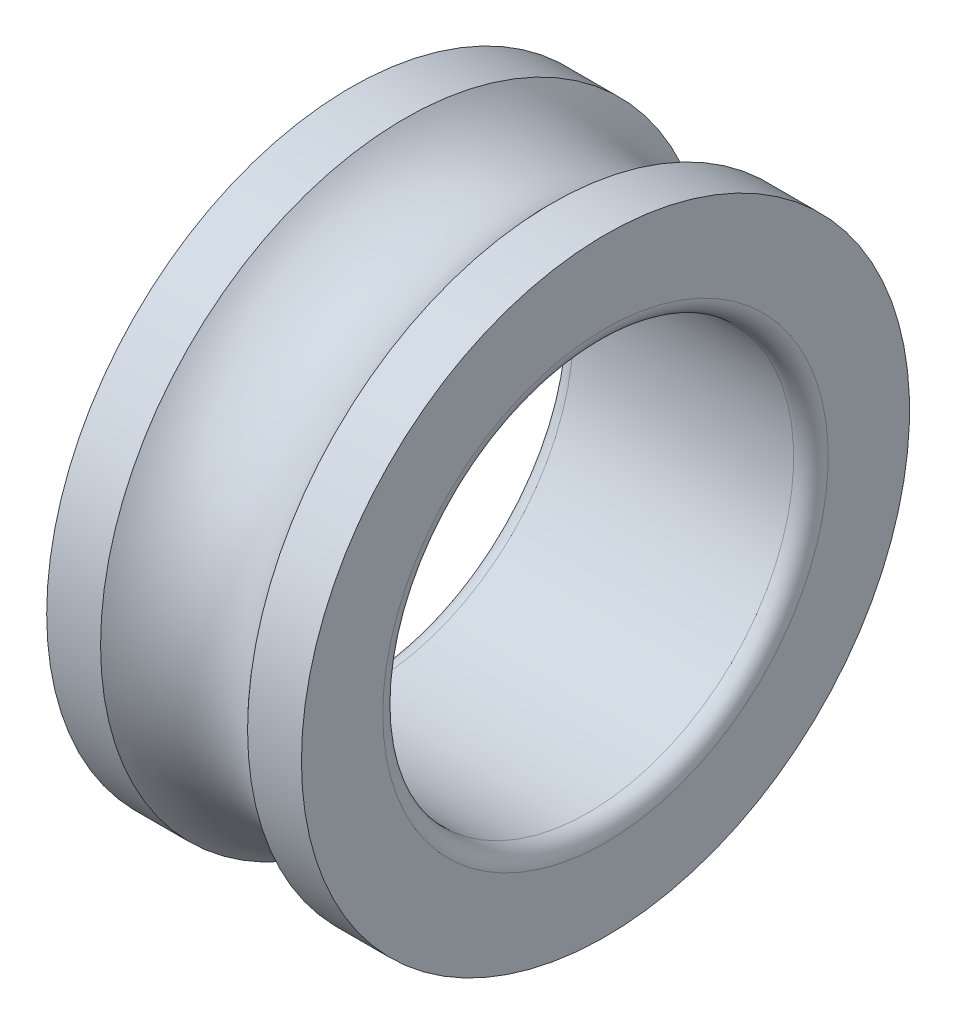
from build123d import *


with BuildPart() as part:
    # Sketch1 → Revolve1 (revolve)
    with BuildSketch(Plane.XY, mode=Mode.PRIVATE) as revolve1_sk:
        with BuildLine():
            Line((15.5, 37), (8.94427191, 37))
            ThreePointArc((8.94427191, 37), (0, 33), (-8.94427191, 37))
            Line((-8.94427191, 37), (-15.5, 37))
            Line((-15.5, 37), (-15.5, 27.1))
            ThreePointArc((-15.5, 27.1), (-14.88492424, 25.61507576), (-13.4, 25))
            Line((-13.4, 25), (13.4, 25))
            ThreePointArc((13.4, 25), (14.88492424, 25.61507576), (15.5, 27.1))
            Line((15.5, 27.1), (15.5, 37))
        make_face()
    revolve(revolve1_sk.sketch.rotate(Axis((-21.704234973, 0, 0), (1, 0, 0)), 90), axis=Axis((-21.704234973, 0, 0), (1, 0, 0)))


solid = part.part
